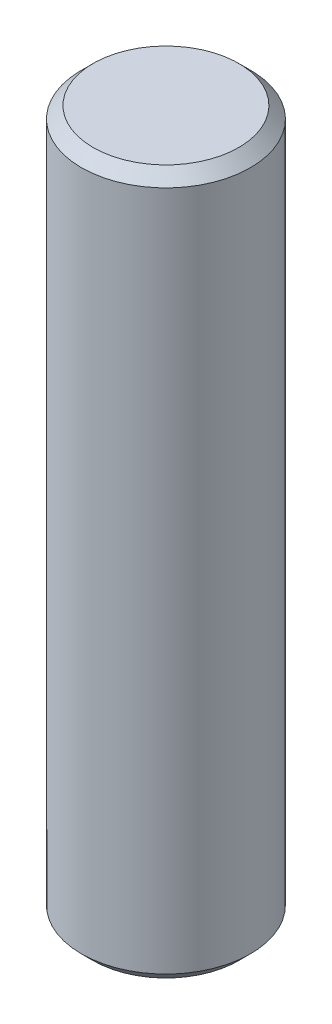
from build123d import *

# Parameters (mm, degrees)
SKETCH_1_R      = 6
EXTRUDE_1_DEPTH = 50
CHAMFER_1_SIZE  = 0.828


with BuildPart() as part:
    # Эскиз1 → Бобышка-Вытянуть1 (new body)
    with BuildSketch(Plane(origin=(0, 0, 0), x_dir=(1, 0, 0), z_dir=(0, 1, 0))):
        with Locations(Location((0, 0, 0), (0, 0, 270))):
            Circle(SKETCH_1_R)
    extrude(amount=EXTRUDE_1_DEPTH)

    # Фаска1
    chamfer_1_edges = [part.edges().sort_by_distance(p)[0] for p in [
        (0, 0, -6),
        (0, 50, -6),
    ]]
    chamfer(chamfer_1_edges, length=CHAMFER_1_SIZE)


solid = part.part
